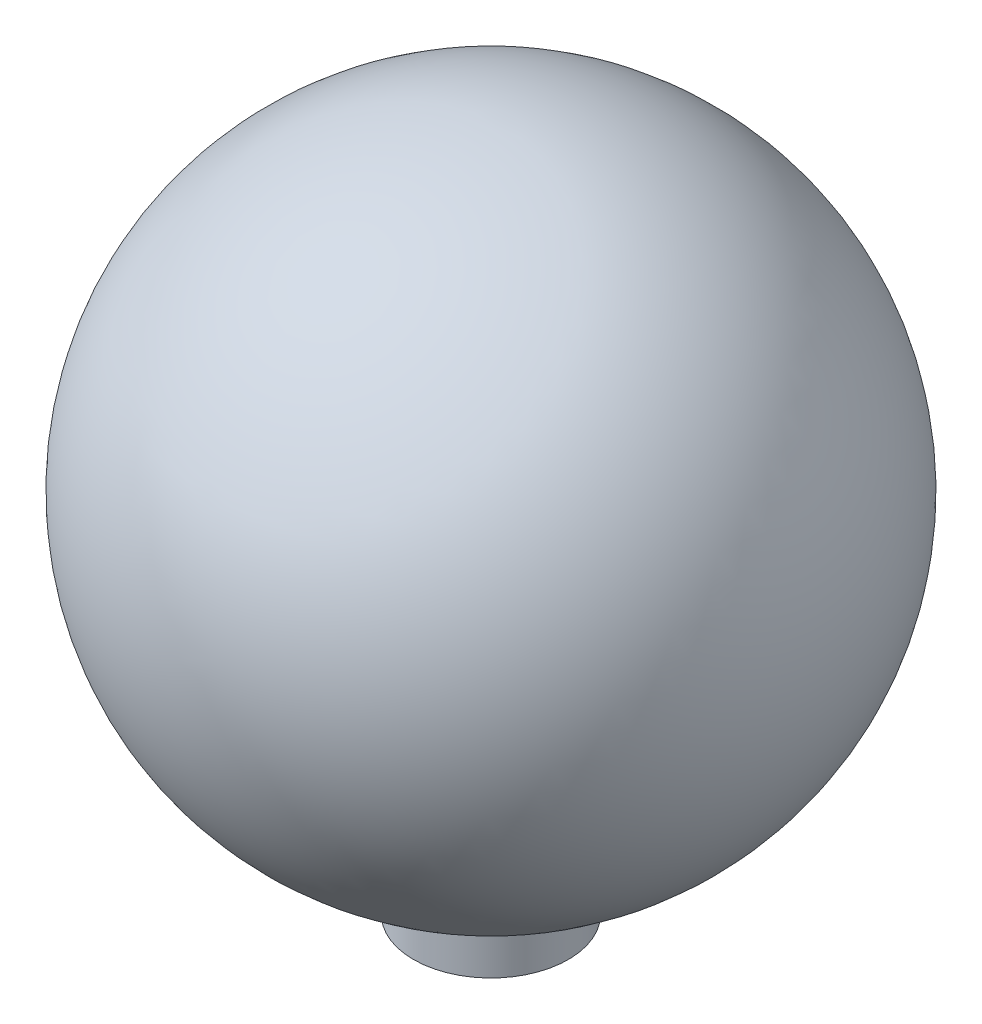
from build123d import *

# Parameters (mm, degrees)
SKETCH1_R                      = 3.175
BOSS_EXTRUDE1_DEPTH            = 2.54
DOME1_FACE_RADIUS              = 3.175
DOME1_HEIGHT                   = 25.4
SKETCH8_R                      = 1.5875
CUT_EXTRUDE1_DEPTH             = 6.35
F_4_0_209_DIAMETER_HOLE1_D     = 5.3086
F_4_0_209_DIAMETER_HOLE1_DEPTH = 6.35
F_4_0_209_DIAMETER_HOLE1_TIP   = 1.594864341


with BuildPart() as part:
    # Sketch1 → Boss-Extrude1 (new body)
    with BuildSketch(Plane(origin=(0, 0, 0), x_dir=(1, 0, 0), z_dir=(0, 1, 0))):
        with Locations(Location((0, 0, 0), (0, 0, 270))):
            Circle(SKETCH1_R)
    extrude(amount=BOSS_EXTRUDE1_DEPTH)

    # Dome1: a dome of height H over a round flat face of radius A is a cap of a sphere of radius (A * A + H * H) / (2 * H)
    dome1_r = (DOME1_FACE_RADIUS * DOME1_FACE_RADIUS + DOME1_HEIGHT * DOME1_HEIGHT) / (2 * DOME1_HEIGHT)
    dome1_base = Plane((0, 2.54, 0), z_dir=(0, 1, 0))
    with Locations(dome1_base.offset(DOME1_HEIGHT - dome1_r)):
        dome1_ball = Sphere(dome1_r, mode=Mode.PRIVATE)
    add(split(dome1_ball, bisect_by=dome1_base, keep=Keep.TOP, mode=Mode.PRIVATE))

    # Sketch8 → Cut-Extrude1 (cut)
    with BuildSketch(Plane.XZ):
        with Locations(Location((0, 0, 0), (0, 0, 270))):
            Circle(SKETCH8_R)
    extrude(amount=-CUT_EXTRUDE1_DEPTH, mode=Mode.SUBTRACT)

    # #4 (0.209) Diameter Hole1
    with Locations(Plane(origin=(0, 0, 0), x_dir=(-1, 0, 0), z_dir=(0, -1, 0))):
        with Locations((0, 0)):
            Hole(F_4_0_209_DIAMETER_HOLE1_D / 2, depth=F_4_0_209_DIAMETER_HOLE1_DEPTH)
            with Locations((0, 0, -(F_4_0_209_DIAMETER_HOLE1_DEPTH + F_4_0_209_DIAMETER_HOLE1_TIP / 2))):  # 118° drill point
                Cone(0, F_4_0_209_DIAMETER_HOLE1_D / 2, F_4_0_209_DIAMETER_HOLE1_TIP, mode=Mode.SUBTRACT)


solid = part.part
